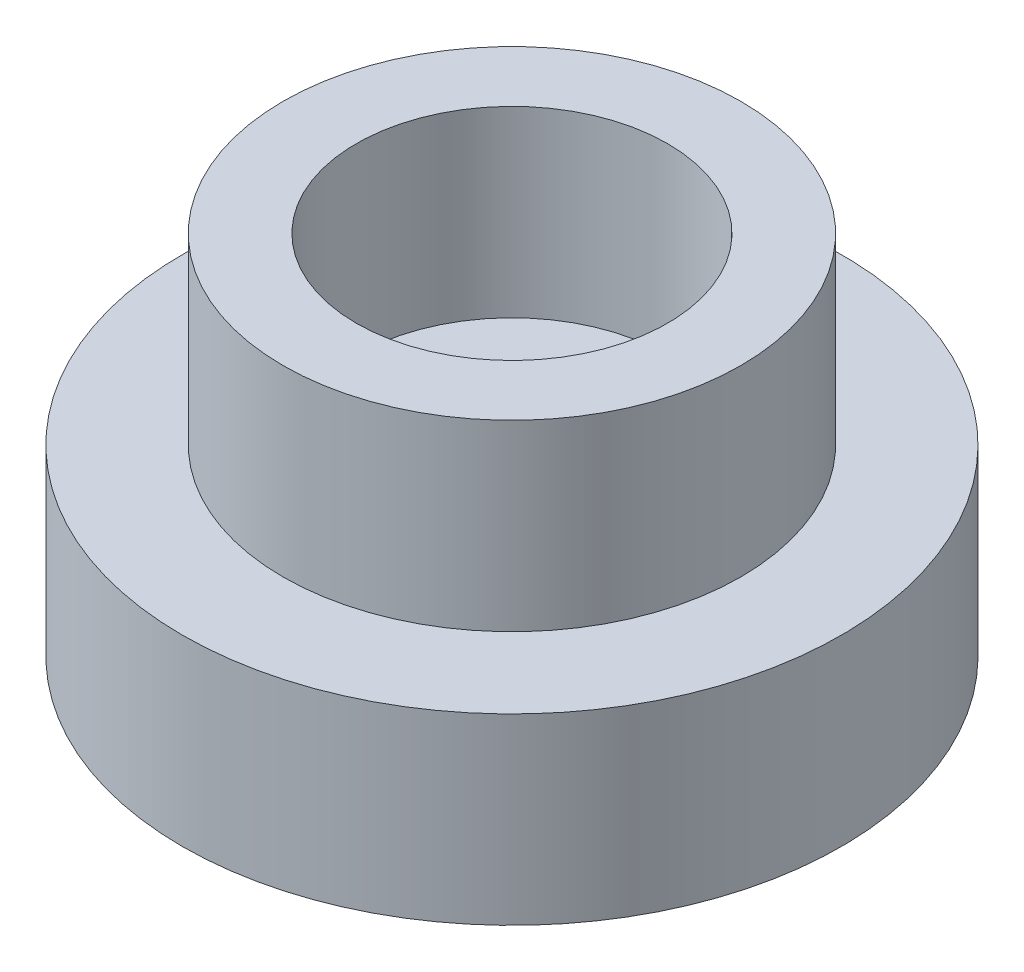
from build123d import *

# Parameters (mm, degrees)
SKETCH1_R           = 9
BOSS_EXTRUDE1_DEPTH = 5
SKETCH2_R           = 6.25
SKETCH2_R_2         = 4.25
BOSS_EXTRUDE3_DEPTH = 5


with BuildPart() as part:
    # Sketch1 → Boss-Extrude1 (new body)
    with BuildSketch(Plane(origin=(0, 0, 0), x_dir=(1, 0, 0), z_dir=(0, 1, 0))):
        with Locations(Location((0, 0, 0), (0, 0, 270))):
            Circle(SKETCH1_R)
    extrude(amount=BOSS_EXTRUDE1_DEPTH)

    # Sketch2 → Boss-Extrude3 (add)
    with BuildSketch(Plane(origin=(0, 5, 0), x_dir=(1, 0, 0), z_dir=(0, 1, 0))):
        with Locations(Location((0, 0, 0), (0, 0, 270))):
            Circle(SKETCH2_R)
        with Locations(Location((0, 0, 0), (0, 0, 270))):
            Circle(SKETCH2_R_2, mode=Mode.SUBTRACT)
    extrude(amount=BOSS_EXTRUDE3_DEPTH)


solid = part.part
